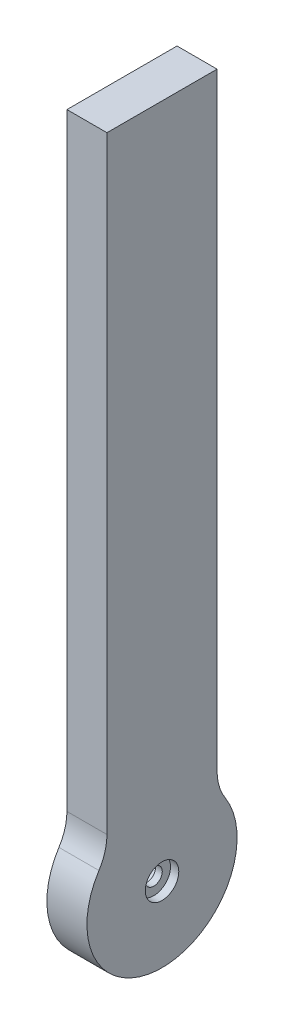
from build123d import *

# Parameters (mm, degrees)
SKETCH1_W                       = 44
SKETCH1_H                       = 150
BOSS_EXTRUDE1_DEPTH             = 8
CUT_EXTRUDE3_DEPTH              = 5
SKETCH3_OUTSIDE_W               = 77.304
SKETCH3_OUTSIDE_H               = 183.304
CUT_EXTRUDE4_DEPTH              = 8
CBORE_FOR_M3_SBHCS1_D           = 3.4
CBORE_FOR_M3_SBHCS1_CBORE_D     = 6.7
CBORE_FOR_M3_SBHCS1_CBORE_DEPTH = 1.65


with BuildPart() as part:
    # Sketch1 → Boss-Extrude1 (new body)
    with BuildSketch(Plane(origin=(0, 0, 0), x_dir=(0, 0, -1), z_dir=(1, 0, 0))):
        with Locations((22, 75)):
            Rectangle(SKETCH1_W, SKETCH1_H)
    extrude(amount=BOSS_EXTRUDE1_DEPTH)

    # Sketch2 → Cut-Extrude3 (cut)
    with BuildSketch(Plane(origin=(0, 0, 0), x_dir=(0, 0, -1), z_dir=(1, 0, 0))):
        Polygon((22, 19), (18.535898385, 17), (18.535898385, 13), (22, 11), (25.464101615, 13), (25.464101615, 17), align=None)
    extrude(amount=CUT_EXTRUDE3_DEPTH, mode=Mode.SUBTRACT)

    # Sketch3 outside → Cut-Extrude4 (cut)
    with BuildSketch(Plane(origin=(8, 0, 0), x_dir=(0, 0, -1), z_dir=(1, 0, 0))):
        with Locations((22, 75)):
            Rectangle(SKETCH3_OUTSIDE_W, SKETCH3_OUTSIDE_H)
        with BuildLine():
            Line((11, 150), (11, 28.564659966))
            ThreePointArc((11, 28.564659966), (10.591663047, 25.736232842), (9.4, 23.13879598))
            ThreePointArc((9.4, 23.13879598), (22, 0), (34.6, 23.13879598))
            ThreePointArc((34.6, 23.13879598), (33.408336953, 25.736232842), (33, 28.564659966))
            Line((33, 28.564659966), (33, 150))
            Line((33, 150), (11, 150))
        make_face(mode=Mode.SUBTRACT)
    extrude(amount=-CUT_EXTRUDE4_DEPTH, mode=Mode.SUBTRACT)

    # CBORE for M3 SBHCS1 (through all)
    with Locations(Plane(origin=(8, 0, 0), x_dir=(0, 0, -1), z_dir=(1, 0, 0))):
        with Locations((22, 15)):
            CounterBoreHole(CBORE_FOR_M3_SBHCS1_D / 2, CBORE_FOR_M3_SBHCS1_CBORE_D / 2, CBORE_FOR_M3_SBHCS1_CBORE_DEPTH)


solid = part.part
